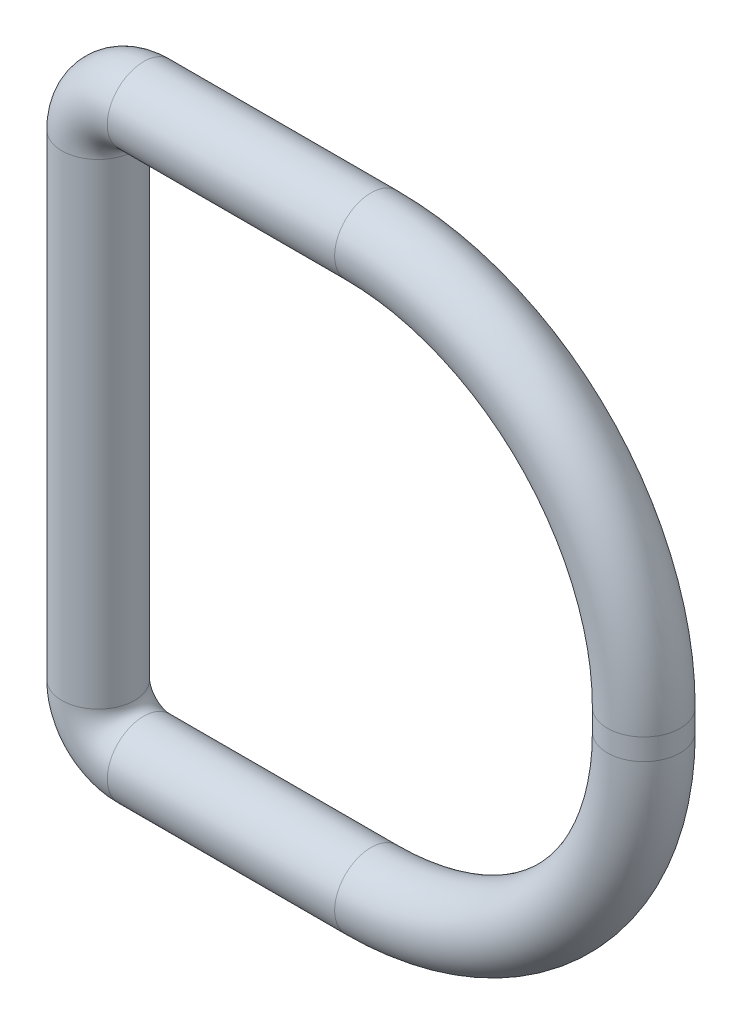
from build123d import *

# Parameters (mm, degrees)
ESQUISSE2_R = 2


with BuildPart() as part:
    # Balayage2: sweep along a path in Esquisse1
    with BuildLine(Plane.XY) as balayage2_path:
        Line((2.5, 25.67292166), (2.5, -0.5))
        ThreePointArc((2.5, -0.5), (3.232233047, -2.267766953), (5, -3))
        Line((5, -3), (17.5, -3))
        ThreePointArc((17.5, -3), (28.106601718, 1.393398282), (32.5, 12))
        Line((32.5, 12), (32.5, 13.17292166))
        ThreePointArc((32.5, 13.17292166), (28.106601718, 23.779523378), (17.5, 28.17292166))
        Line((17.5, 28.17292166), (5, 28.17292166))
        ThreePointArc((5, 28.17292166), (3.232233047, 27.440688613), (2.5, 25.67292166))
    # Esquisse2 → Balayage2 (sweep)
    with BuildSketch(Plane(origin=(0, 0, 0), x_dir=(1, 0, 0), z_dir=(0, 1, 0))):
        with Locations((2.5, 0)):
            Circle(ESQUISSE2_R)
    sweep(path=balayage2_path.line)


solid = part.part
